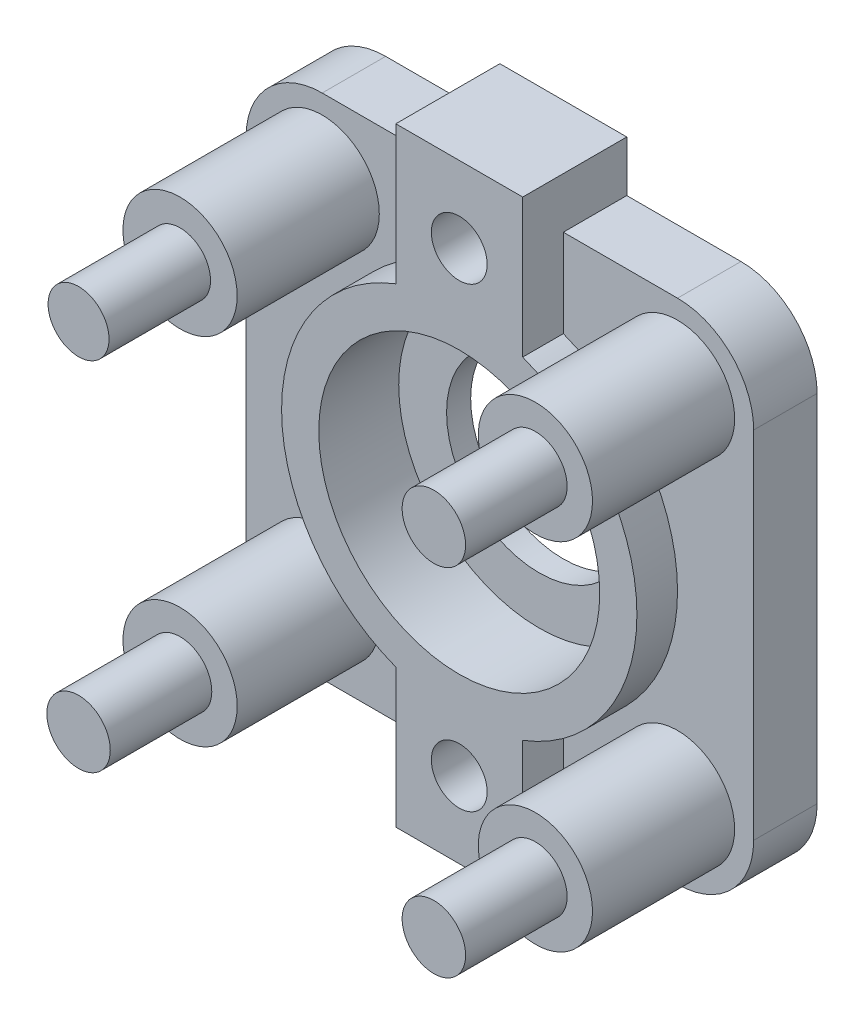
from build123d import *

# Parameters (mm, degrees)
EXTRUDE_1_DEPTH     = 1.5
SKETCH_4_R          = 2.25
EXTRUDE_2_DEPTH     = 6.6
SKETCH_5_R          = 1.2
SKETCH_5_R_2        = 1.25
EXTRUDE_3_DEPTH     = 4
SKETCH_6_R          = 7
EXTRUDE_4_DEPTH     = 2.6
SKETCH_7_R          = 5.535
CUT_EXTRUDE_1_DEPTH = 3.15
SKETCH_8_R          = 3.65
CUT_EXTRUDE_2_DEPTH = 5.65
EXTRUDE_6_REACH     = 18.248
SKETCH_11_W         = 5
SKETCH_11_H         = 5.997078986
SKETCH_12_R         = 2.1
CUT_EXTRUDE_5_DEPTH = 1.2
SKETCH_13_R         = 1.1
CUT_EXTRUDE_6_DEPTH = 26.5
EXTRUDE_7_DEPTH     = 1


with BuildPart() as part:
    # 草图1 → 凸台-拉伸1 (new body)
    with BuildSketch(Plane.XY):
        with BuildLine():
            Line((-7, -10), (7, -10))
            ThreePointArc((7, -10), (9.121320344, -9.121320344), (10, -7))
            Line((10, -7), (10, 7))
            ThreePointArc((10, 7), (9.121320344, 9.121320344), (7, 10))
            Line((7, 10), (-7, 10))
            ThreePointArc((-7, 10), (-9.121320344, 9.121320344), (-10, 7))
            Line((-10, 7), (-10, -7))
            ThreePointArc((-10, -7), (-9.121320344, -9.121320344), (-7, -10))
        make_face()
    extrude(amount=EXTRUDE_1_DEPTH)

    # 草图4 → 凸台-拉伸2 (add)
    with BuildSketch(Plane.XY.offset(1.5)):
        with Locations((-7, -7)):
            Circle(SKETCH_4_R)
        with Locations((7, -7)):
            Circle(SKETCH_4_R)
        with Locations((7, 7)):
            Circle(SKETCH_4_R)
        with Locations((-7, 7)):
            Circle(SKETCH_4_R)
    extrude(amount=EXTRUDE_2_DEPTH)

    # 草图5 → 凸台-拉伸3 (add)
    with BuildSketch(Plane.XY.offset(8.1)):
        with Locations((-7, 7)):
            Circle(SKETCH_5_R)
        with Locations((-7, -7)):
            Circle(SKETCH_5_R_2)
        with Locations((7, -7)):
            Circle(SKETCH_5_R_2)
        with Locations((7, 7)):
            Circle(SKETCH_5_R_2)
    extrude(amount=EXTRUDE_3_DEPTH)

    # 草图6 → 凸台-拉伸4 (add)
    with BuildSketch(Plane.XY.offset(1.5)):
        Circle(SKETCH_6_R)
    extrude(amount=EXTRUDE_4_DEPTH)

    # 草图7 → 切除-拉伸1 (cut)
    with BuildSketch(Plane.XY.offset(4.1)):
        Circle(SKETCH_7_R)
    extrude(amount=-CUT_EXTRUDE_1_DEPTH, mode=Mode.SUBTRACT)

    # 草图8 → 切除-拉伸2 (cut)
    with BuildSketch(Plane.XY.offset(0.95)):
        Circle(SKETCH_8_R)
    extrude(amount=-CUT_EXTRUDE_2_DEPTH, mode=Mode.SUBTRACT)

    # 凸台-拉伸6: up to this face of the body (flat: up to its plane)
    extrude_6_end = Plane(part.part.faces().sort_by_distance((0, -9.717157288, 0))[0])
    # 草图11 → 凸台-拉伸6 (add, up to the picked face)
    with BuildSketch(Plane.XY.offset(4.1), mode=Mode.PRIVATE) as extrude_6_sk1:
        with Locations((0, 9.001460507)):
            Rectangle(SKETCH_11_W, SKETCH_11_H)
    extrude_6_tool1 = split(extrude(extrude_6_sk1.sketch, amount=-EXTRUDE_6_REACH, mode=Mode.PRIVATE), bisect_by=extrude_6_end, keep=Keep.BOTH, mode=Mode.PRIVATE)
    extrude_6 = extrude_6_tool1.solids().sort_by(Axis((0, 9.001461, 4.1), (0, 0, -1)))[0]
    add(extrude_6)

    # 草图12 → 切除-拉伸5 (cut)
    with BuildSketch(Plane(origin=(0, 0, 0), x_dir=(-1, 0, 0), z_dir=(0, 0, -1))):
        with Locations((0, 9)):
            Circle(SKETCH_12_R)
    cut_extrude_5 = extrude(amount=-CUT_EXTRUDE_5_DEPTH, mode=Mode.SUBTRACT)

    # 镜向1: 凸台-拉伸6, 切除-拉伸5 across plane
    add(extrude_6.mirror(Plane.ZX))
    add(cut_extrude_5.mirror(Plane.ZX), mode=Mode.SUBTRACT)

    # 草图13 → 切除-拉伸6 (cut)
    with BuildSketch(Plane(origin=(0, 0, 1.2), x_dir=(-1, 0, 0), z_dir=(0, 0, -1))):
        with Locations((0, 9)):
            Circle(SKETCH_13_R)
        with Locations((0, -9)):
            Circle(SKETCH_13_R)
    extrude(amount=-CUT_EXTRUDE_6_DEPTH, mode=Mode.SUBTRACT)

    # 草图14 → 凸台-拉伸7 (add)
    with BuildSketch(Plane.XY.offset(1.5)):
        with BuildLine():
            Line((-7, -10), (-2.5, -10))
            Line((-2.5, -10), (-2.5, -6.538348415))
            ThreePointArc((-2.5, -6.538348415), (-7, 0), (-2.5, 6.538348415))
            Line((-2.5, 6.538348415), (-2.5, 10))
            Line((-2.5, 10), (-7, 10))
            ThreePointArc((-7, 10), (-9.121320344, 9.121320344), (-10, 7))
            Line((-10, 7), (-10, -7))
            ThreePointArc((-10, -7), (-9.121320344, -9.121320344), (-7, -10))
        make_face()
        with BuildLine():
            Line((2.5, -6.538348415), (2.5, -10))
            Line((2.5, -10), (7, -10))
            ThreePointArc((7, -10), (9.121320344, -9.121320344), (10, -7))
            Line((10, -7), (10, 7))
            ThreePointArc((10, 7), (9.121320344, 9.121320344), (7, 10))
            Line((7, 10), (2.5, 10))
            Line((2.5, 10), (2.5, 6.538348415))
            ThreePointArc((2.5, 6.538348415), (7, 0), (2.5, -6.538348415))
        make_face()
    extrude(amount=EXTRUDE_7_DEPTH)


solid = part.part
